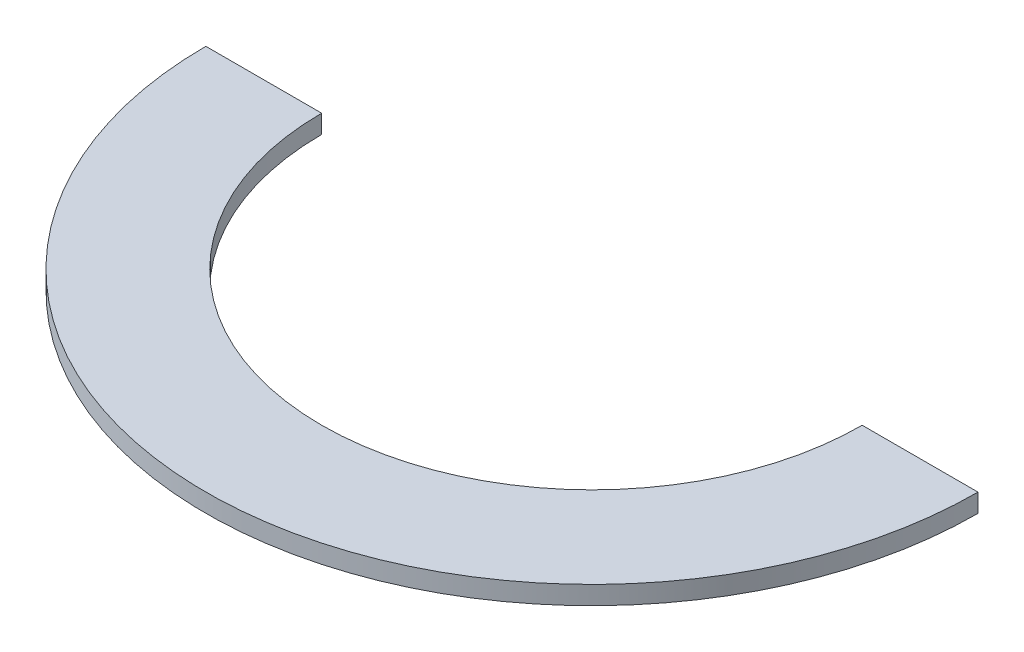
from build123d import *

# Parameters (mm, degrees)
BOSS_EXTRUDE1_DEPTH = 2.3875


with BuildPart() as part:
    # Sketch1 → Boss-Extrude1 (new body)
    with BuildSketch(Plane(origin=(0, 0, 0), x_dir=(1, 0, 0), z_dir=(0, 1, 0))):
        with BuildLine():
            Line((-50, 0), (-35, 0))
            ThreePointArc((-35, 0), (0, -35), (35, 0))
            Line((35, 0), (50, 0))
            ThreePointArc((50, 0), (0, -50), (-50, 0))
        make_face()
    extrude(amount=BOSS_EXTRUDE1_DEPTH)


solid = part.part
